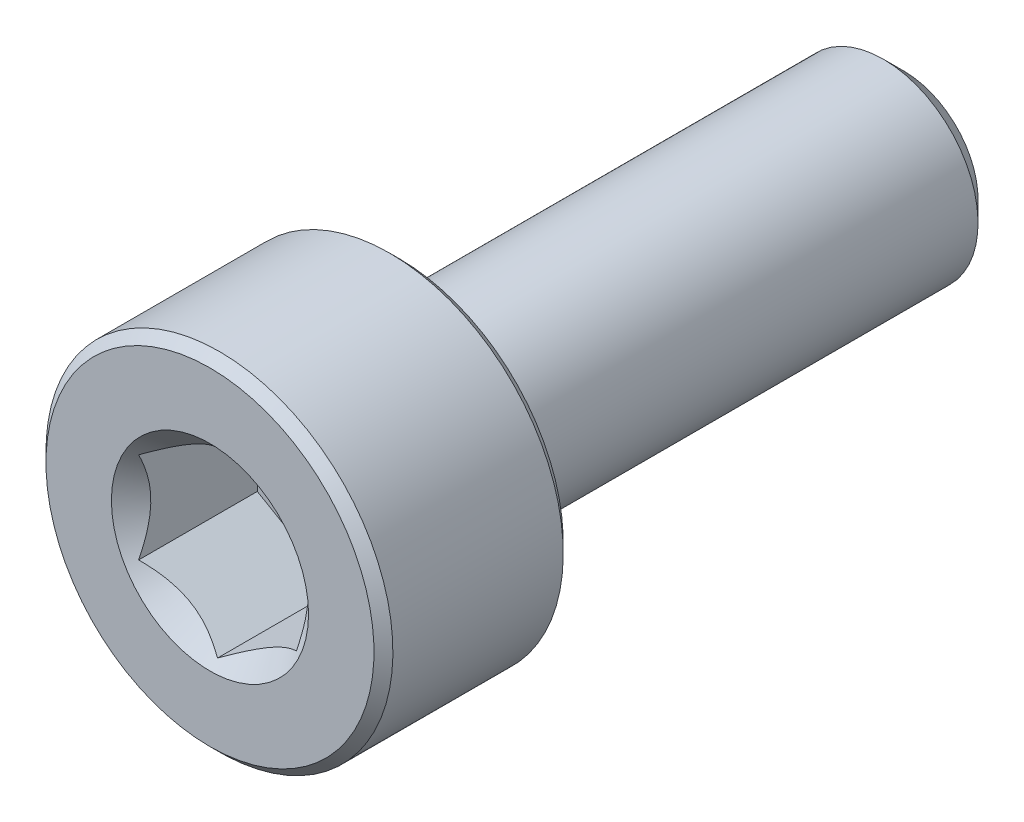
from build123d import *

# Parameters (mm, degrees)
CUT_EXTRUDE1_DEPTH = 2
SKETCH4_R          = 1.5625
CUT_EXTRUDE2_DEPTH = 1.5
CUT_EXTRUDE2_DRAFT = -45


with BuildPart() as part:
    # Sketch2 → Revolve1 (revolve)
    with BuildSketch(Plane(origin=(0, 0, 0), x_dir=(0, 0, -1), z_dir=(1, 0, 0))):
        with BuildLine():
            Line((-5.5, 0), (-5.5, 2.6))
            Line((-5.5, 2.6), (-5.35, 2.75))
            Line((-5.35, 2.75), (-2.65, 2.75))
            Line((-2.65, 2.75), (-2.5, 2.6))
            Line((-2.5, 2.6), (-2.5, 1.65))
            ThreePointArc((-2.5, 1.65), (-2.456066017, 1.543933983), (-2.35, 1.5))
            Line((-2.35, 1.5), (5.175240474, 1.5))
            Line((5.175240474, 1.5), (5.5, 1.175240474))
            Line((5.5, 1.175240474), (5.5, 0))
            Line((5.5, 0), (-5.5, 0))
        make_face()
    revolve(axis=Axis((0, 0, -5.5), (0, 0, 1)))

    # Sketch3 → Cut-Extrude1 (cut)
    with BuildSketch(Plane.XY.offset(5.5)):
        Polygon((1.25, -0.721687836), (1.25, 0.721687836), (0, 1.443375673), (-1.25, 0.721687836), (-1.25, -0.721687836), (0, -1.443375673), align=None)
    extrude(amount=-CUT_EXTRUDE1_DEPTH, mode=Mode.SUBTRACT)


with BuildPart() as cut_extrude2_tool:
    # Sketch4 → Cut-Extrude2 (with draft: the straight prism first)
    with BuildSketch(Plane.XY.offset(5.5)):
        Circle(SKETCH4_R)
    extrude(amount=-CUT_EXTRUDE2_DEPTH)
    # Cut-Extrude2: the draft: its side faces are tilted about the plane it starts from
    cut_extrude2_sides = [cut_extrude2_tool.faces().sort_by_distance(p)[0] for p in [
        (-1.5625, 0, 4.75),
    ]]
    draft(cut_extrude2_sides, Plane.XY.offset(5.5), CUT_EXTRUDE2_DRAFT)


with BuildPart() as part_1:
    add(part.part)

    # Cut-Extrude2: cut by cut_extrude2_tool
    add(cut_extrude2_tool.part, mode=Mode.SUBTRACT)


solid = part_1.part
